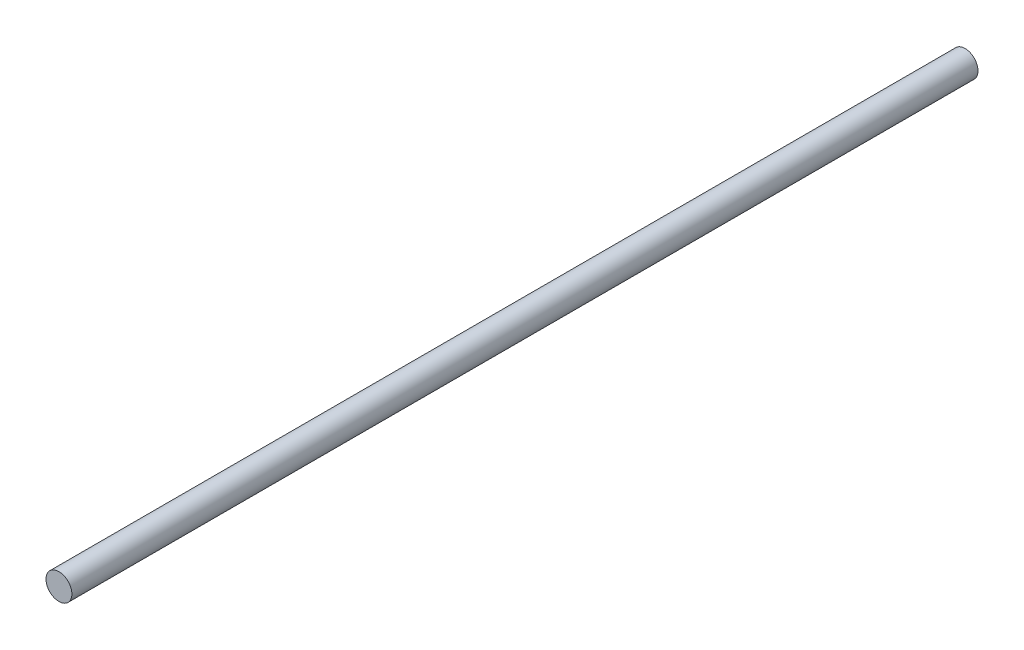
from build123d import *

# Parameters (mm, degrees)
SKETCH1_R           = 2
BOSS_EXTRUDE1_DEPTH = 140


with BuildPart() as part:
    # Sketch1 → Boss-Extrude1 (new body)
    with BuildSketch(Plane.XY):
        Circle(SKETCH1_R)
    extrude(amount=BOSS_EXTRUDE1_DEPTH)


solid = part.part
